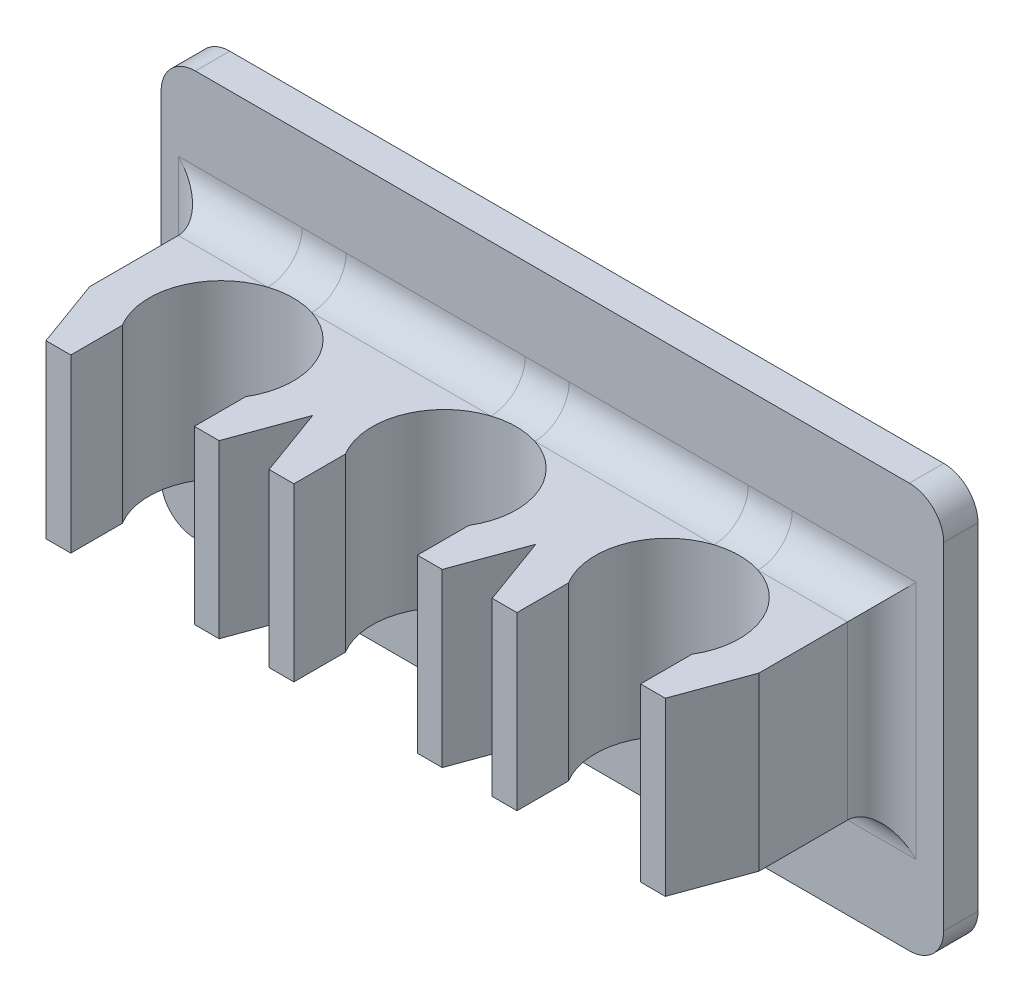
from build123d import *

# Parameters (mm, degrees)
SKETCH1_W           = 22.8
SKETCH1_H           = 11.8
BOSS_EXTRUDE1_DEPTH = 1
BOSS_EXTRUDE2_DEPTH = 2.5
LPATTERN2_COUNT     = 3
LPATTERN2_PITCH     = 6.5
FILLET1_R           = 1
FILLET2_R           = 1


with BuildPart() as part:
    # Sketch1 → Boss-Extrude1 (new body)
    with BuildSketch(Plane.XY):
        Rectangle(SKETCH1_W, SKETCH1_H)
    extrude(amount=BOSS_EXTRUDE1_DEPTH)

    # Sketch3 → Boss-Extrude2 (add, symmetric)
    with BuildSketch(Plane.XZ):
        with BuildLine():
            Line((-9.9, 1), (-9.9, 4.581665383))
            Line((-9.9, 4.581665383), (-9.172059531, 6.581665383))
            Line((-9.172059531, 6.581665383), (-8.45, 6.581665383))
            Line((-8.45, 6.581665383), (-8.45, 5.081665383))
            ThreePointArc((-8.45, 5.081665383), (-6.65, 1.9), (-4.85, 5.081665383))
            Line((-4.85, 5.081665383), (-4.85, 6.581665383))
            Line((-4.85, 6.581665383), (-4.127940469, 6.581665383))
            Line((-4.127940469, 6.581665383), (-3.4, 4.581665383))
            Line((-3.4, 4.581665383), (-3.4, 1))
            Line((-3.4, 1), (-9.9, 1))
        make_face()
    boss_extrude2 = extrude(amount=BOSS_EXTRUDE2_DEPTH, both=True)

    # LPattern2: Boss-Extrude2 ×3
    with Locations(*[(i * LPATTERN2_PITCH, 0, 0) for i in range(1, LPATTERN2_COUNT)]):
        add(boss_extrude2)

    # Fillet1
    fillet1_edges = [part.edges().sort_by_distance(p)[0] for p in [
        (-11.4, 5.9, 0.5),
        (11.4, 5.9, 0.5),
        (11.4, -5.9, 0.5),
        (-11.4, -5.9, 0.5),
    ]]
    fillet(fillet1_edges, radius=FILLET1_R)

    # Fillet2
    fillet2_edges = [part.edges().sort_by_distance(p)[0] for p in [
        (-0.15, 2.5, 1),
        (-9.9, 0, 1),
        (-0.15, -2.5, 1),
        (9.6, 0, 1),
    ]]
    fillet(fillet2_edges, radius=FILLET2_R)


solid = part.part
